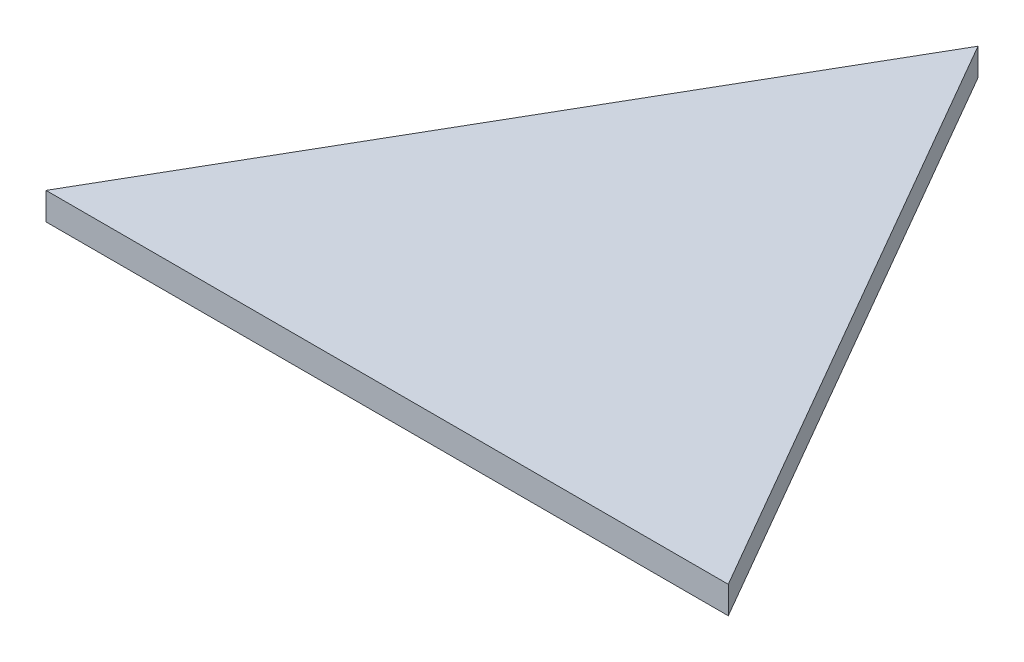
from build123d import *

# Parameters (mm, degrees)
BOSS_EXTRUDE1_DEPTH = 2


with BuildPart() as part:
    # Sketch1 → Boss-Extrude1 (new body)
    with BuildSketch(Plane(origin=(0, 0, 0), x_dir=(1, 0, 0), z_dir=(0, 1, 0))):
        Polygon((0, 0), (50, 0), (25, 43.301270189), align=None)
    extrude(amount=BOSS_EXTRUDE1_DEPTH)


solid = part.part
